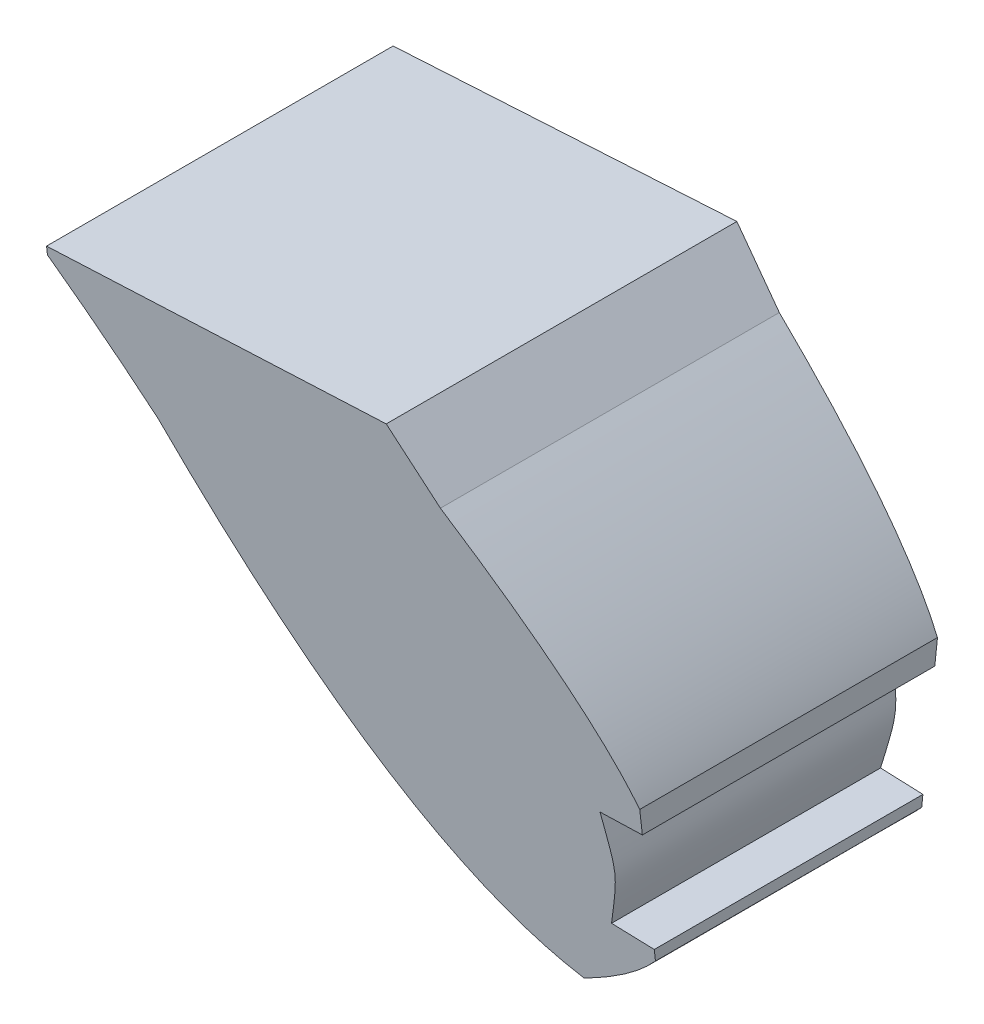
from build123d import *

# Parameters (mm, degrees)
SALIENTE_EXTRUIR1_DEPTH      = 7.21
SALIENTE_EXTRUIR2_DEPTH      = 7.21
SALIENTE_EXTRUIR2_DEPTH_BACK = 7.21
CORTAR_EXTRUIR2_DEPTH        = 28.232395202
CORTAR_EXTRUIR2_DEPTH_BACK   = 28.232395202


with BuildPart() as part:
    # Croquis1 → Saliente-Extruir1 (new, symmetric)
    with BuildSketch(Plane.XY):
        with BuildLine():
            add(Edge.make_bspline(
                [(-18.945192114, 7.540918896), (-10.215008384, -3.697644103), (-2.846604825, -5.059081104)],
                knots=[0.497667241, 0.497667241, 0.497667241, 0.49955428, 0.49955428, 0.49955428], degree=2, weights=[1, 1, 1]))
            add(Edge.make_bspline(
                [(-2.846604825, -5.059081104), (-0.742366882, -3.9352066), (0.355125, -2.723253227)],
                knots=[0.498812075, 0.498812075, 0.498812075, 0.499412845, 0.499412845, 0.499412845], degree=2, weights=[1, 1, 1]))
            Line((0.355125, -2.723253227), (0.355125, -2.284841781))
            Line((0.355125, -2.284841781), (-1.394875, -2.223730435))
            add(Edge.make_bspline(
                [(-1.394875, -2.223730435), (-0.90753067, -0.123730435), (-1.394875, 1.976269565)],
                knots=[0, 0, 0, 1, 1, 1], degree=2, weights=[1, 3.231801219, 1]))
            Line((-1.394875, 1.976269565), (0.355125, 2.284841781))
            Line((0.355125, 2.284841781), (0.355125, 3.001549529))
            add(Edge.make_bspline(
                [(0.355125, 3.001549529), (-1.44872627, 6.058427314), (-6.994875026, 10.477389992)],
                knots=[0.500820705, 0.500820705, 0.500820705, 0.502013312, 0.502013312, 0.502013312], degree=2, weights=[1, 1, 1]))
            Line((-6.994875026, 10.477389992), (-8.981845695, 12.608155172))
            Line((-8.981845695, 12.608155172), (-23.035921146, 11.871612288))
            Line((-23.035921146, 11.871612288), (-23.035921146, 11.54013782))
            ThreePointArc((-23.035921146, 11.54013782), (-20.949684518, 9.582335705), (-18.945192114, 7.540918896))
        make_face()
    extrude(amount=SALIENTE_EXTRUIR1_DEPTH, both=True)

    # Croquis4 → Saliente-Extruir2 (add, two sides: drawn at the far end of the back side and taken through both)
    with BuildSketch(Plane.XY.offset(-SALIENTE_EXTRUIR2_DEPTH_BACK)):
        Polygon((-1.394875, 1.976269565), (0.355125, 2.284841781), (0.355125, 2.037380912), align=None)
    extrude(amount=SALIENTE_EXTRUIR2_DEPTH + SALIENTE_EXTRUIR2_DEPTH_BACK)

    # Croquis6 → Cortar-Extruir2 (cut, two sides: drawn at the far end of the back side and taken through both)
    with BuildSketch(Plane(origin=(0, 0, 0), x_dir=(0, 0, -1), z_dir=(1, 0, 0)).offset(-CORTAR_EXTRUIR2_DEPTH_BACK)):
        Polygon((7.21, 12.608155172), (7.21, -5.059081104), (5.21, -5.059081104), align=None)
        Polygon((-7.21, 12.608155172), (-7.21, -5.059081104), (-5.21, -5.059081104), align=None)
    extrude(amount=CORTAR_EXTRUIR2_DEPTH + CORTAR_EXTRUIR2_DEPTH_BACK, mode=Mode.SUBTRACT)


solid = part.part
